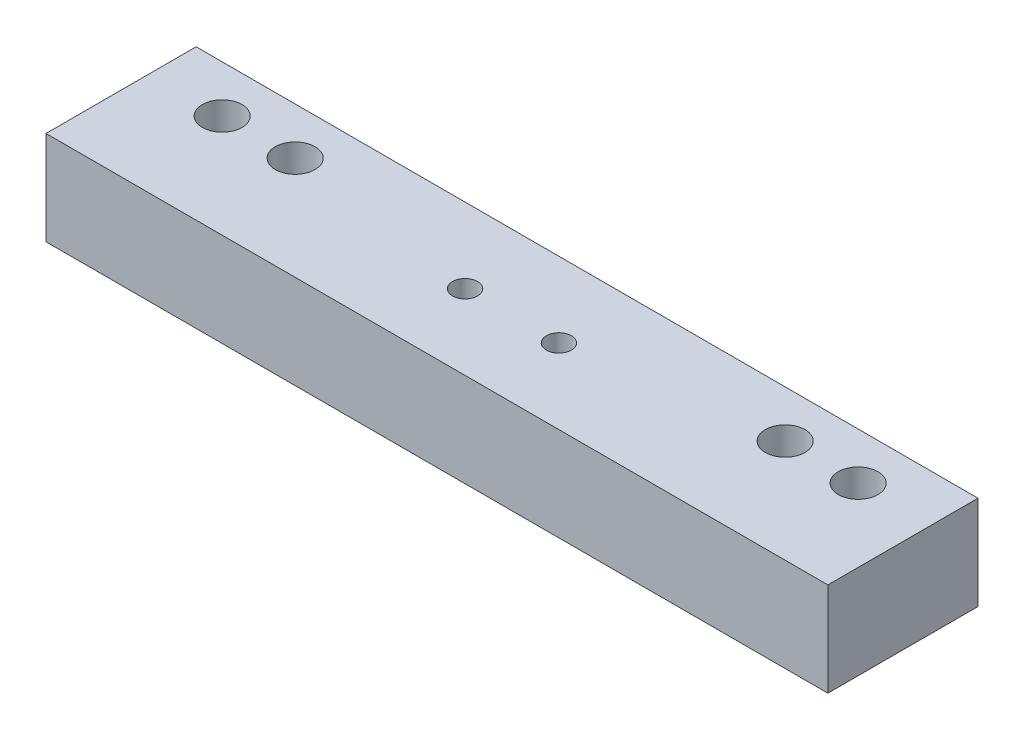
from build123d import *

# Parameters (mm, degrees)
SKETCH1_W           = 125
SKETCH1_H           = 24
BOSS_EXTRUDE1_DEPTH = 15
SKETCH2_R           = 3.175
CUT_EXTRUDE1_DEPTH  = 129.163957492
SKETCH5_R           = 2
CUT_EXTRUDE2_DEPTH  = 129.163957492


with BuildPart() as part:
    # Sketch1 → Boss-Extrude1 (new body)
    with BuildSketch(Plane(origin=(0, 0, 0), x_dir=(1, 0, 0), z_dir=(0, 1, 0))):
        with Locations((62.5, 12)):
            Rectangle(SKETCH1_W, SKETCH1_H)
    extrude(amount=BOSS_EXTRUDE1_DEPTH)

    # Sketch2 → Cut-Extrude1 (cut, symmetric)
    with BuildSketch(Plane(origin=(0, 15, 0), x_dir=(1, 0, 0), z_dir=(0, 1, 0))):
        with Locations(Location((113.333333333, 16.5, 0), (0, 0, 270))):
            Circle(SKETCH2_R)
        with Locations(Location((101.666666667, 16.5, 0), (0, 0, 270))):
            Circle(SKETCH2_R)
    cut_extrude1 = extrude(amount=CUT_EXTRUDE1_DEPTH, both=True, mode=Mode.SUBTRACT)

    # Mirror1: Cut-Extrude1 across plane
    add(cut_extrude1.mirror(Plane.ZY.offset(-62.5)), mode=Mode.SUBTRACT)

    # Sketch5 → Cut-Extrude2 (cut, through all)
    with BuildSketch(Plane(origin=(0, 15, 0), x_dir=(1, 0, 0), z_dir=(0, 1, 0))):
        with Locations(Location((70, 12, 0), (0, 0, 270))):
            Circle(SKETCH5_R)
    cut_extrude2 = extrude(amount=-CUT_EXTRUDE2_DEPTH, mode=Mode.SUBTRACT)

    # Mirror2: Cut-Extrude2 across plane
    add(cut_extrude2.mirror(Plane.ZY.offset(-62.5)), mode=Mode.SUBTRACT)


solid = part.part
